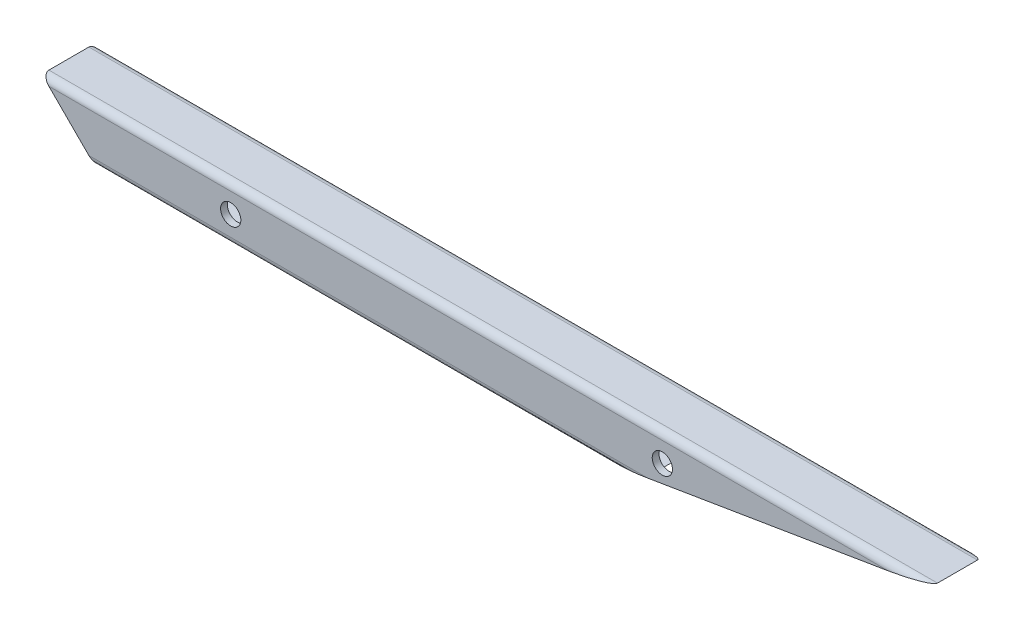
from build123d import *

# Parameters (mm, degrees)
BOSS_EXTRUDE1_DEPTH = 418.338
SKETCH2_R           = 4.7625
CUT_EXTRUDE1_DEPTH  = 420.87736572


with BuildPart() as part:
    # Sketch1 → Boss-Extrude1 (new body)
    with BuildSketch(Plane(origin=(0, 0, 0), x_dir=(0, 0, -1), z_dir=(1, 0, 0))):
        with BuildLine():
            Line((3.302, 0), (22.098, 0))
            ThreePointArc((22.098, 0), (24.432866591, 0.967133409), (25.4, 3.302))
            Line((25.4, 3.302), (25.4, 22.098))
            ThreePointArc((25.4, 22.098), (24.432866591, 24.432866591), (22.098, 25.4))
            Line((22.098, 25.4), (3.302, 25.4))
            ThreePointArc((3.302, 25.4), (0.967133409, 24.432866591), (0, 22.098))
            Line((0, 22.098), (0, 3.302))
            ThreePointArc((0, 3.302), (0.967133409, 0.967133409), (3.302, 0))
        make_face()
        with BuildLine():
            Line((6.223, 3.175), (19.177, 3.175))
            ThreePointArc((19.177, 3.175), (21.332261469, 4.067738531), (22.225, 6.223))
            Line((22.225, 6.223), (22.225, 19.177))
            ThreePointArc((22.225, 19.177), (21.332261469, 21.332261469), (19.177, 22.225))
            Line((19.177, 22.225), (6.223, 22.225))
            ThreePointArc((6.223, 22.225), (4.067738531, 21.332261469), (3.175, 19.177))
            Line((3.175, 19.177), (3.175, 6.223))
            ThreePointArc((3.175, 6.223), (4.067738531, 4.067738531), (6.223, 3.175))
        make_face(mode=Mode.SUBTRACT)
    extrude(amount=BOSS_EXTRUDE1_DEPTH)

    # Sketch2 → Cut-Extrude1 (cut, through all)
    with BuildSketch(Plane.XY):
        with Locations((88.9, 12.7)):
            Circle(SKETCH2_R)
        with Locations((292.1, 12.7)):
            Circle(SKETCH2_R)
        Polygon((0, 0), (0, 25.4), (25.4, 0), align=None)
        Polygon((418.338, 0), (265.303, 0), (418.338, 25.4), align=None)
    extrude(amount=-CUT_EXTRUDE1_DEPTH, mode=Mode.SUBTRACT)


solid = part.part
